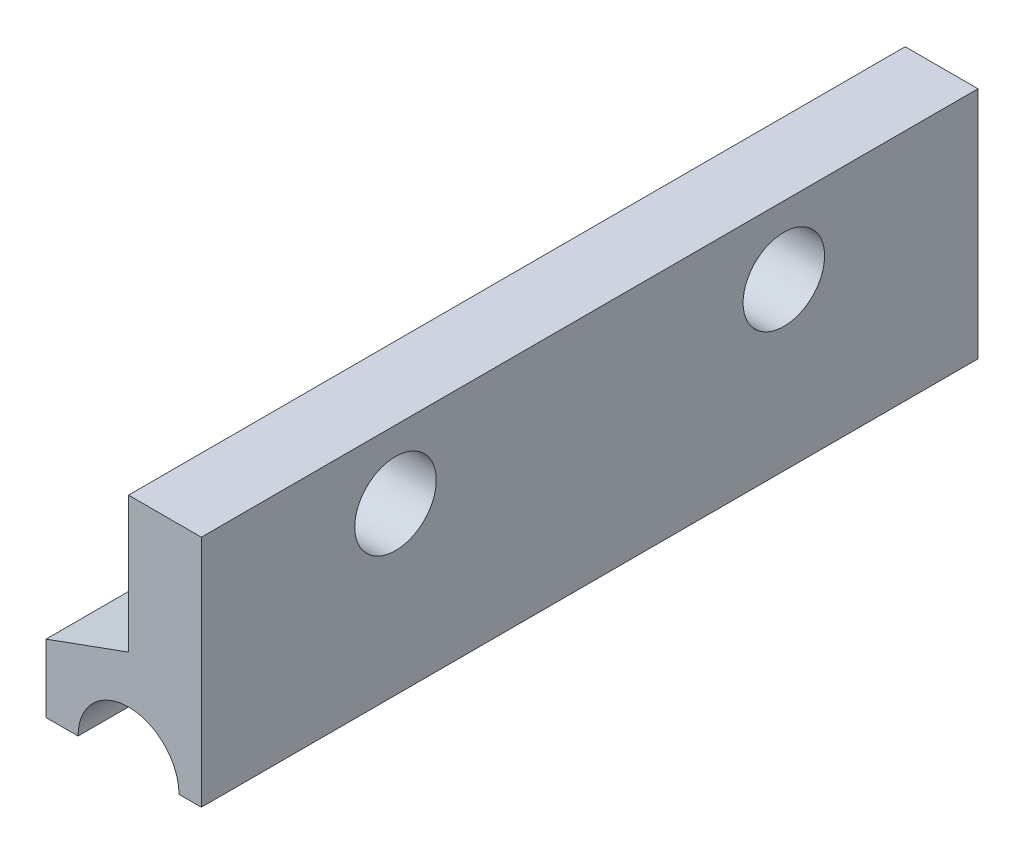
from build123d import *

# Parameters (mm, degrees)
BOSS_EXTRUDE1_DEPTH = 40
SKETCH2_R           = 2.1
CUT_EXTRUDE1_DEPTH  = 42.990351999


with BuildPart() as part:
    # Sketch1 → Boss-Extrude1 (new body)
    with BuildSketch(Plane.XY):
        with BuildLine():
            Line((-2.6, 0), (-4.25, 0))
            Line((-4.25, 0), (-4.25, 3.5))
            Line((-4.25, 3.5), (0, 5.046873496))
            Line((0, 5.046873496), (0, 12.046873496))
            Line((0, 12.046873496), (3.75, 12.046873496))
            Line((3.75, 12.046873496), (3.75, 0))
            Line((3.75, 0), (2.6, 0))
            ThreePointArc((2.6, 0), (0, 2.6), (-2.6, 0))
        make_face()
    extrude(amount=BOSS_EXTRUDE1_DEPTH)

    # Sketch2 → Cut-Extrude1 (cut, through all)
    with BuildSketch(Plane.ZY):
        with Locations((10, 8.546873496)):
            Circle(SKETCH2_R)
        with Locations((30, 8.546873496)):
            Circle(SKETCH2_R)
    extrude(amount=-CUT_EXTRUDE1_DEPTH, mode=Mode.SUBTRACT)


solid = part.part
